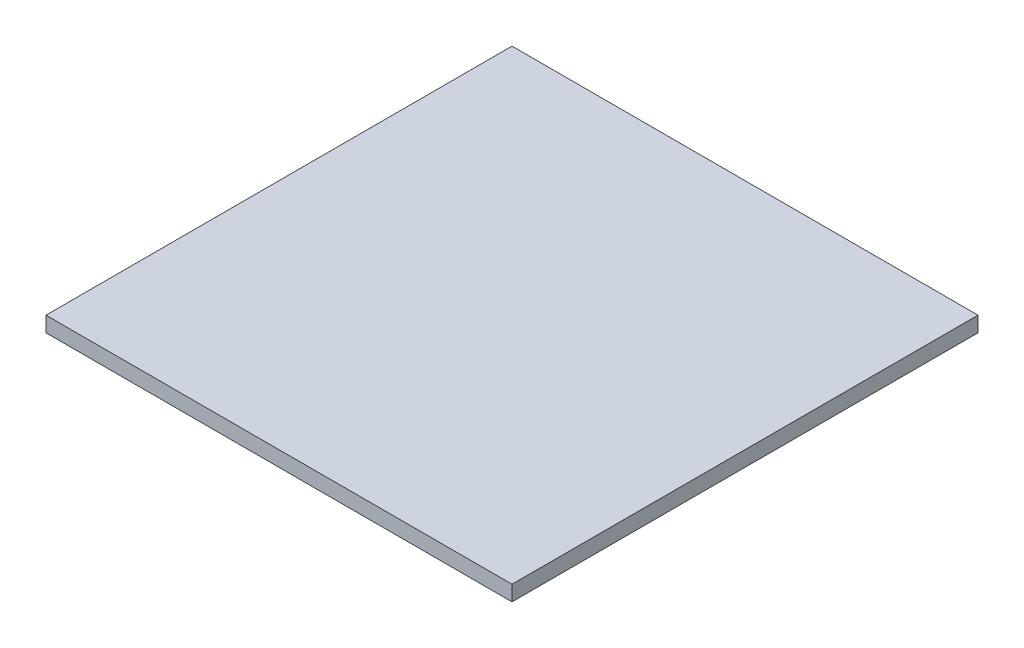
from build123d import *

# Parameters (mm, degrees)
SKETCH1_W           = 304.8
SKETCH1_H           = 304.8
BOSS_EXTRUDE1_DEPTH = 10


with BuildPart() as part:
    # Sketch1 → Boss-Extrude1 (new body)
    with BuildSketch(Plane(origin=(0, 0, 0), x_dir=(1, 0, 0), z_dir=(0, 1, 0))):
        Rectangle(SKETCH1_W, SKETCH1_H)
    extrude(amount=BOSS_EXTRUDE1_DEPTH)


solid = part.part
